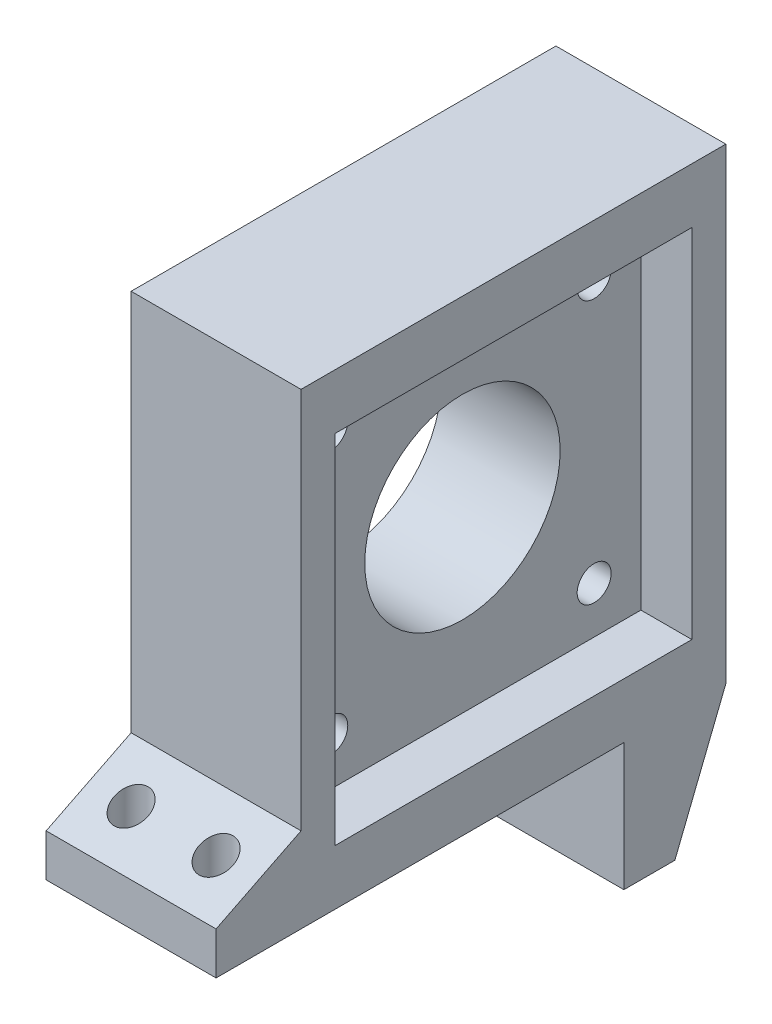
from build123d import *

# Parameters (mm, degrees)
SKETCH1_W           = 20
SKETCH1_H           = 50
BOSS_EXTRUDE1_DEPTH = 70
SKETCH2_R           = 2
SKETCH2_R_2         = 11.5
CUT_EXTRUDE2_DEPTH  = 60
SKETCH4_W           = 38
SKETCH4_H           = 15
CUT_EXTRUDE3_DEPTH  = 60
SKETCH8_R           = 2
CUT_EXTRUDE5_DEPTH  = 15
SKETCH9_W           = 42
SKETCH9_H           = 42
CUT_EXTRUDE6_DEPTH  = 6
SKETCH10_R          = 2
CUT_EXTRUDE7_DEPTH  = 7
CUT_EXTRUDE8_DEPTH  = 30
SKETCH12_W          = 20
SKETCH12_H          = 5
BOSS_EXTRUDE2_DEPTH = 10
BOSS_EXTRUDE3_DEPTH = 20
SKETCH15_R          = 2
CUT_EXTRUDE9_DEPTH  = 10


with BuildPart() as part:
    # Sketch1 → Boss-Extrude1 (new body)
    with BuildSketch(Plane(origin=(0, 0, 0), x_dir=(1, 0, 0), z_dir=(0, 1, 0))):
        with Locations((-10, -25)):
            Rectangle(SKETCH1_W, SKETCH1_H)
    extrude(amount=BOSS_EXTRUDE1_DEPTH)

    # Sketch2 → Cut-Extrude2 (cut)
    with BuildSketch(Plane(origin=(0, 0, 0), x_dir=(0, 0, -1), z_dir=(1, 0, 0))):
        with Locations((-9.5, 58)):
            Circle(SKETCH2_R)
        with Locations((-25, 42.5)):
            Circle(SKETCH2_R_2)
        with Locations((-9.5, 27)):
            Circle(SKETCH2_R)
        with Locations((-40.5, 27)):
            Circle(SKETCH2_R)
        with Locations((-40.5, 58)):
            Circle(SKETCH2_R)
    extrude(amount=-CUT_EXTRUDE2_DEPTH, mode=Mode.SUBTRACT)

    # Sketch4 → Cut-Extrude3 (cut)
    with BuildSketch(Plane(origin=(0, 0, 0), x_dir=(0, 0, -1), z_dir=(1, 0, 0))):
        with Locations((-31, 7.5)):
            Rectangle(SKETCH4_W, SKETCH4_H)
    extrude(amount=-CUT_EXTRUDE3_DEPTH, mode=Mode.SUBTRACT)

    # Sketch8 → Cut-Extrude5 (cut)
    with BuildSketch(Plane(origin=(0, 0, 0), x_dir=(-1, 0, 0), z_dir=(0, 0, -1))):
        with Locations((15, 6)):
            Circle(SKETCH8_R)
    extrude(amount=-CUT_EXTRUDE5_DEPTH, mode=Mode.SUBTRACT)

    # Sketch9 → Cut-Extrude6 (cut)
    with BuildSketch(Plane(origin=(0, 0, 0), x_dir=(0, 0, -1), z_dir=(1, 0, 0))):
        with Locations((-25, 42.5)):
            Rectangle(SKETCH9_W, SKETCH9_H)
    extrude(amount=-CUT_EXTRUDE6_DEPTH, mode=Mode.SUBTRACT)

    # Sketch10 → Cut-Extrude7 (cut)
    with BuildSketch(Plane(origin=(0, 0, 0), x_dir=(-1, 0, 0), z_dir=(0, 0, -1))):
        with Locations((5, 6)):
            Circle(SKETCH10_R)
    extrude(amount=-CUT_EXTRUDE7_DEPTH, mode=Mode.SUBTRACT)

    # Sketch11 → Cut-Extrude8 (cut)
    with BuildSketch(Plane(origin=(0, 0, 0), x_dir=(0, 0, -1), z_dir=(1, 0, 0))):
        Polygon((-6, 0), (0, 0), (0, 15), align=None)
    extrude(amount=-CUT_EXTRUDE8_DEPTH, mode=Mode.SUBTRACT)

    # Sketch12 → Boss-Extrude2 (add)
    with BuildSketch(Plane.XY.offset(50)):
        with Locations((-10, 17.5)):
            Rectangle(SKETCH12_W, SKETCH12_H)
    extrude(amount=BOSS_EXTRUDE2_DEPTH)

    # Sketch14 → Boss-Extrude3 (add)
    with BuildSketch(Plane(origin=(0, 0, 0), x_dir=(0, 0, -1), z_dir=(1, 0, 0))):
        Polygon((-50, 20), (-60, 20), (-50, 25), align=None)
    extrude(amount=-BOSS_EXTRUDE3_DEPTH)

    # Sketch15 → Cut-Extrude9 (cut)
    with BuildSketch(Plane(origin=(0, 15, 0), x_dir=(-1, 0, 0), z_dir=(0, -1, 0))):
        with Locations(Location((5, -55, 0), (0, 0, 90))):
            Circle(SKETCH15_R)
        with Locations(Location((15, -55, 0), (0, 0, 90))):
            Circle(SKETCH15_R)
    extrude(amount=-CUT_EXTRUDE9_DEPTH, mode=Mode.SUBTRACT)


solid = part.part
